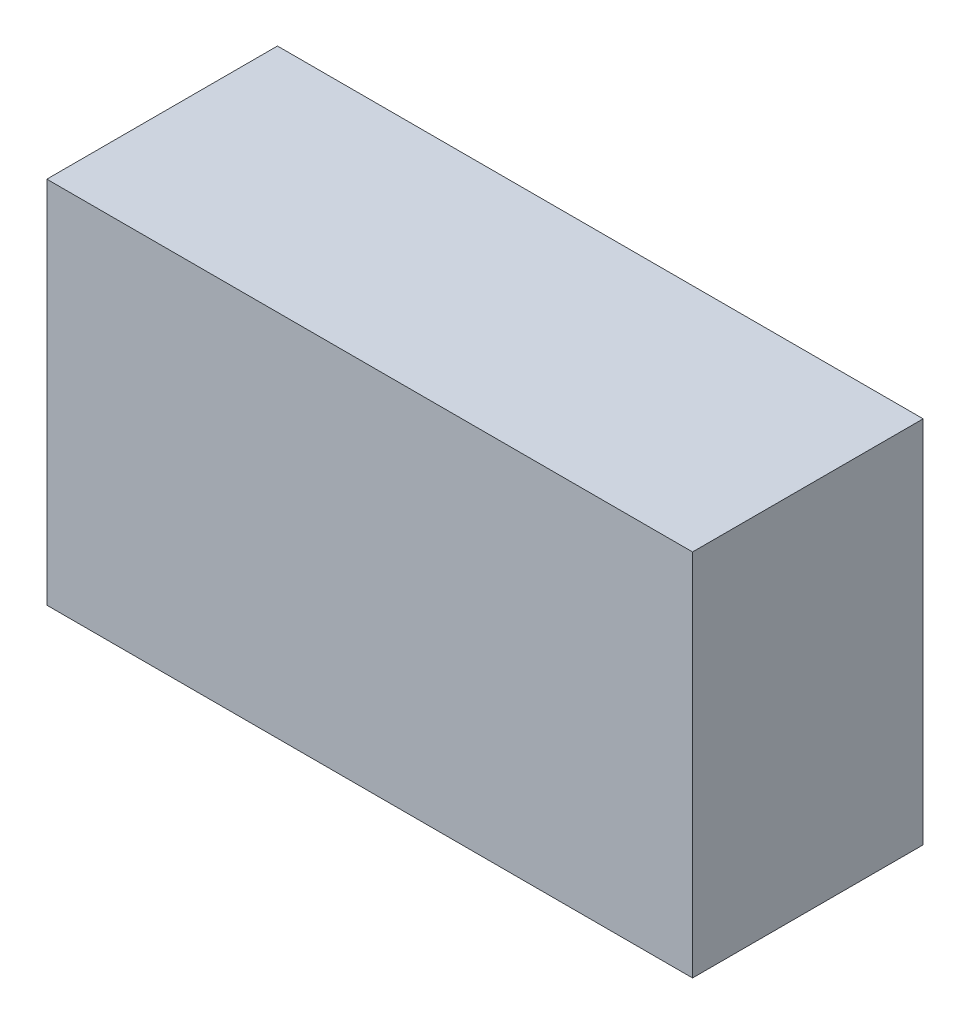
from build123d import *

# Parameters (mm, degrees)
PRESS_UC_CATAL_SIRT_1_START = -550
SKETCH1_W                   = 140
SKETCH1_H                   = 80
PRESS_UC_CATAL_SIRT_1_DEPTH = 50


with BuildPart() as part:
    # Sketch1 → PRESS_uc_catal_sirt_1 (new body)
    with BuildSketch(Plane.XY.offset(PRESS_UC_CATAL_SIRT_1_START)):
        with Locations((350, 1214)):
            Rectangle(SKETCH1_W, SKETCH1_H)
    extrude(amount=-PRESS_UC_CATAL_SIRT_1_DEPTH)


solid = part.part
